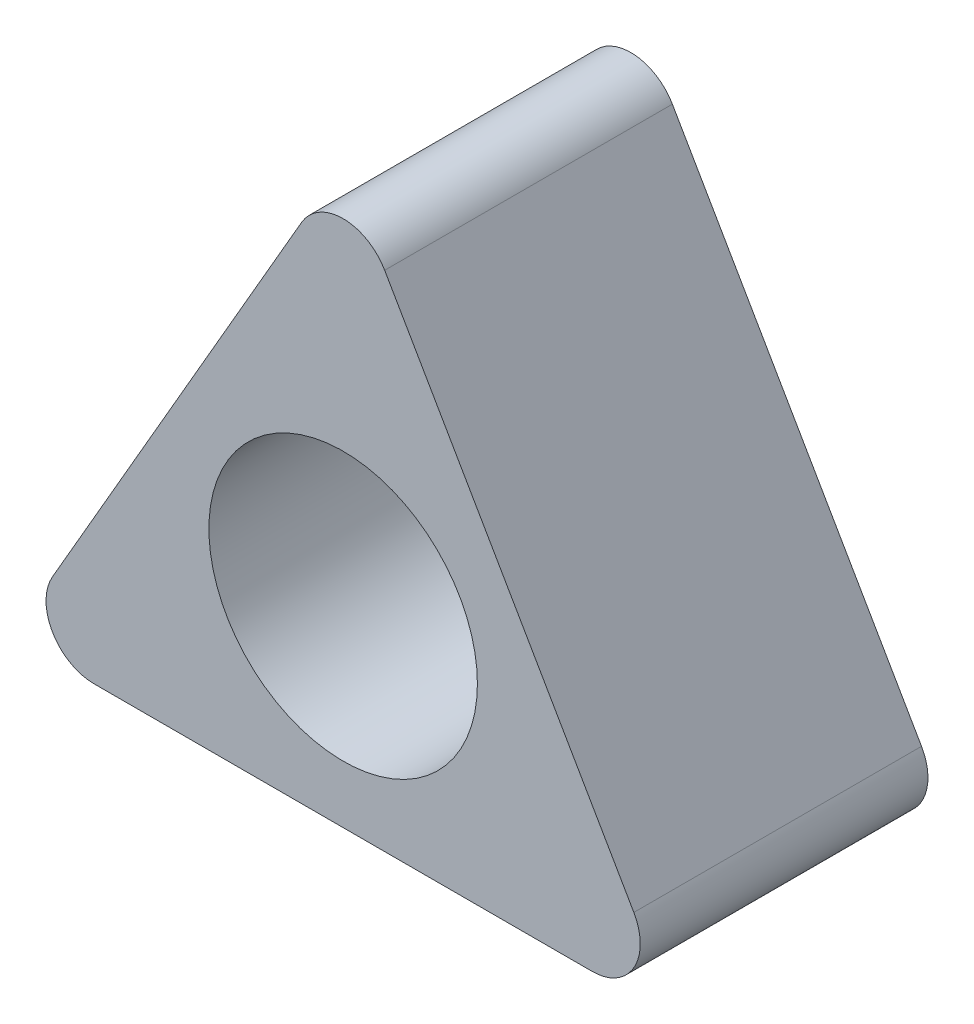
from build123d import *

# Parameters (mm, degrees)
BOSS_EXTRUDE1_DEPTH = 30
FILLET1_R           = 5
SKETCH2_R           = 14
CUT_EXTRUDE1_DEPTH  = 56.541044473


with BuildPart() as part:
    # Sketch1 → Boss-Extrude1 (new body)
    with BuildSketch(Plane.XY):
        Polygon((0, 40), (34.641016151, -20), (-34.641016151, -20), align=None)
    extrude(amount=BOSS_EXTRUDE1_DEPTH)

    # Fillet1
    fillet1_edges = [part.edges().sort_by_distance(p)[0] for p in [
        (0, 40, 15),
        (34.641016151, -20, 15),
        (-34.641016151, -20, 15),
    ]]
    fillet(fillet1_edges, radius=FILLET1_R)

    # Sketch2 → Cut-Extrude1 (cut, through all)
    with BuildSketch(Plane.XY.offset(30)):
        Circle(SKETCH2_R)
    extrude(amount=-CUT_EXTRUDE1_DEPTH, mode=Mode.SUBTRACT)


solid = part.part
